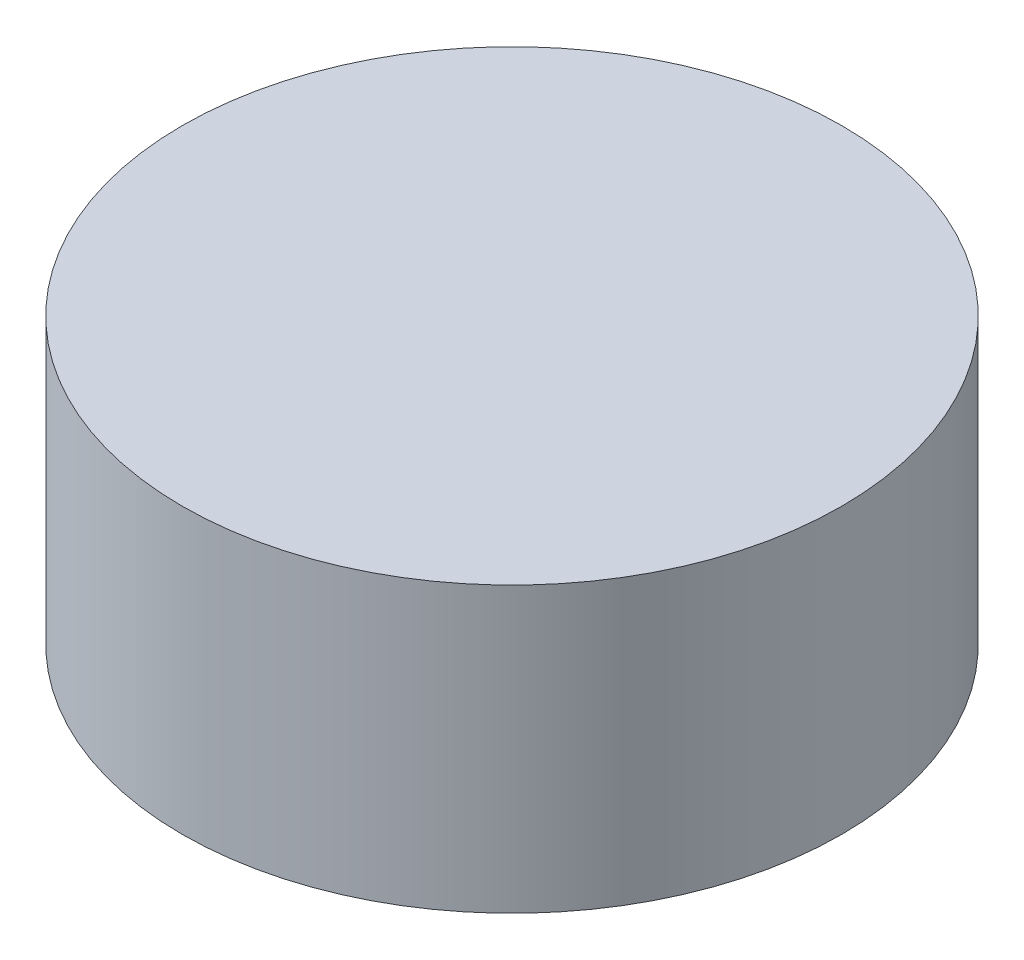
from build123d import *

# Parameters (mm, degrees)
SKETCH1_R           = 29
BOSS_EXTRUDE1_DEPTH = 25


with BuildPart() as part:
    # Sketch1 → Boss-Extrude1 (new body)
    with BuildSketch(Plane(origin=(0, 0, 0), x_dir=(1, 0, 0), z_dir=(0, 1, 0))):
        with Locations(Location((0, 0, 0), (0, 0, 270))):
            Circle(SKETCH1_R)
    extrude(amount=BOSS_EXTRUDE1_DEPTH)


solid = part.part
